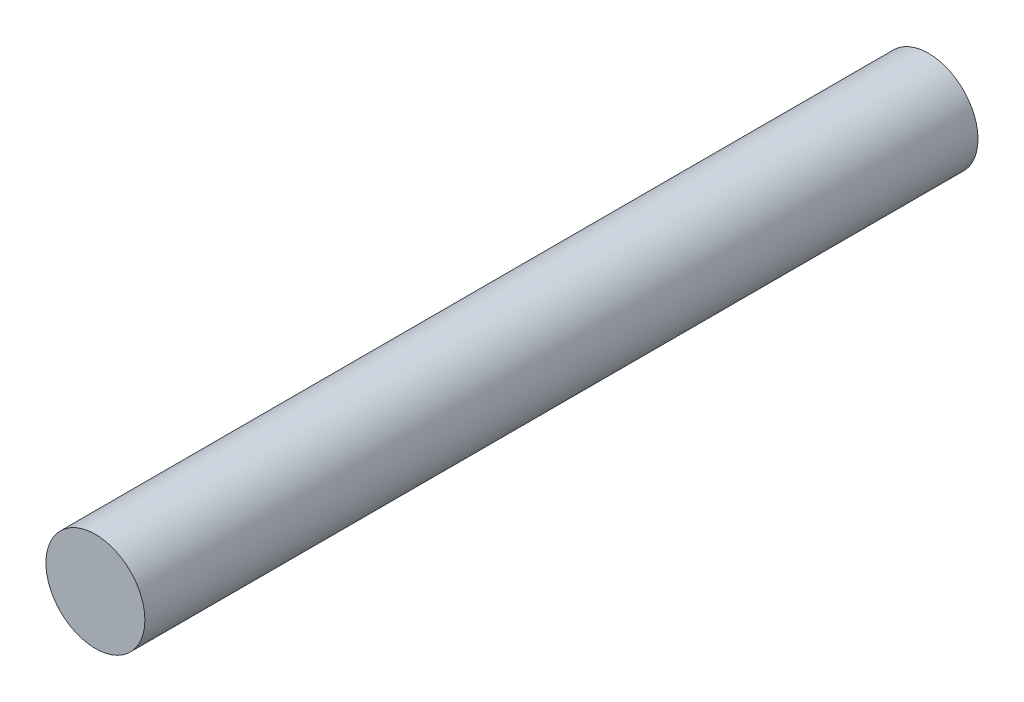
from build123d import *

# Parameters (mm, degrees)
CROQUIS1_R              = 2.575
SALIENTE_EXTRUIR1_DEPTH = 43.35


with BuildPart() as part:
    # Croquis1 → Saliente-Extruir1 (new body)
    with BuildSketch(Plane.XY):
        Circle(CROQUIS1_R)
    extrude(amount=SALIENTE_EXTRUIR1_DEPTH)


solid = part.part
